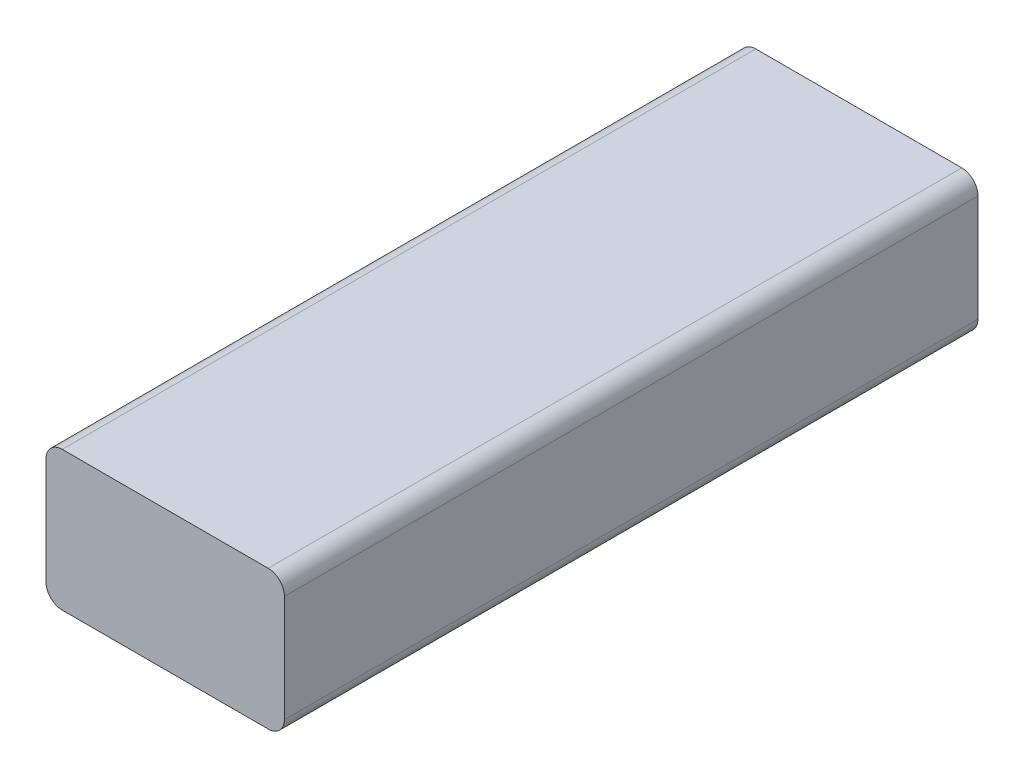
from build123d import *

# Parameters (mm, degrees)
BOSS_EXTRUDE1_DEPTH = 64


with BuildPart() as part:
    # Sketch2 → Boss-Extrude1 (new, symmetric)
    with BuildSketch(Plane.XY):
        with BuildLine():
            Line((-19, -12.85), (19, -12.85))
            ThreePointArc((19, -12.85), (21.121320344, -11.971320344), (22, -9.85))
            Line((22, -9.85), (22, 9.85))
            ThreePointArc((22, 9.85), (21.121320344, 11.971320344), (19, 12.85))
            Line((19, 12.85), (-19, 12.85))
            ThreePointArc((-19, 12.85), (-21.121320344, 11.971320344), (-22, 9.85))
            Line((-22, 9.85), (-22, -9.85))
            ThreePointArc((-22, -9.85), (-21.121320344, -11.971320344), (-19, -12.85))
        make_face()
    extrude(amount=BOSS_EXTRUDE1_DEPTH, both=True)


solid = part.part
